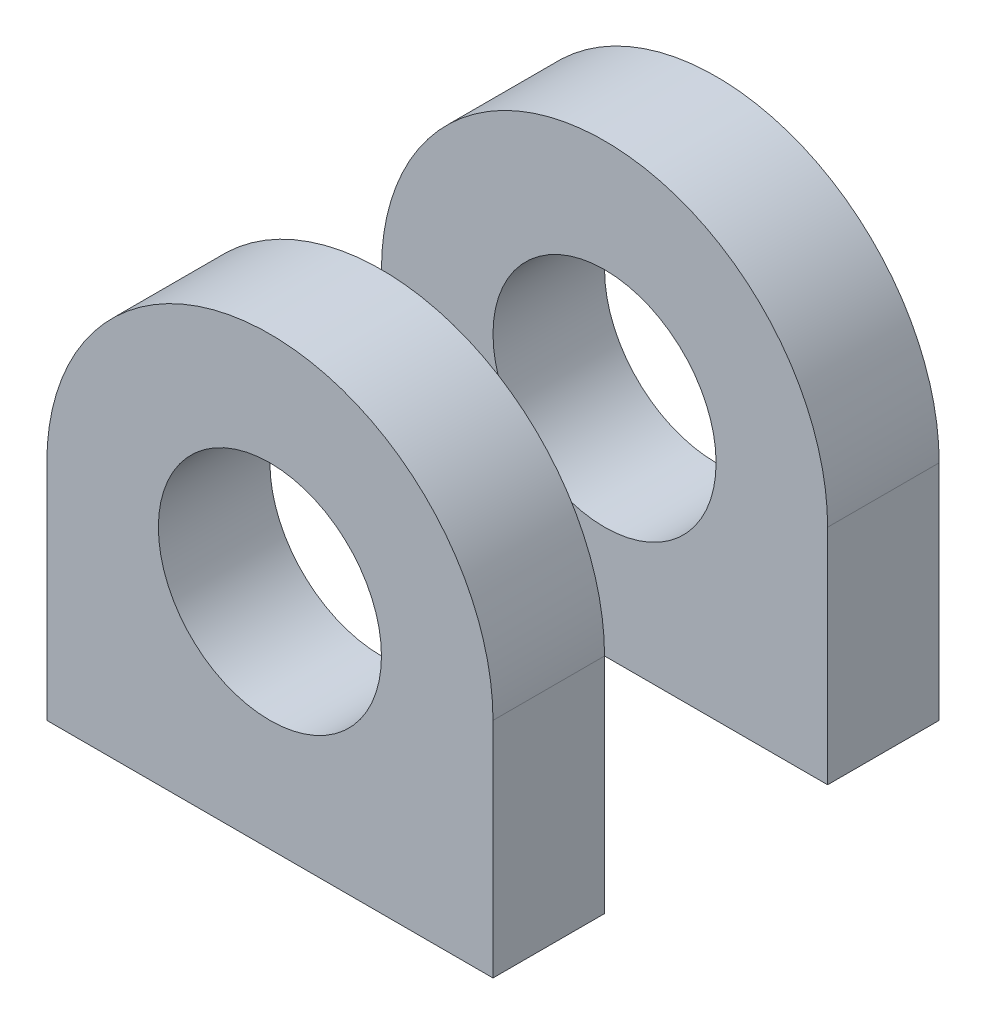
from build123d import *

# Parameters (mm, degrees)
SKETCH_1_W               = 200
SKETCH_1_H               = 200
EXTRUDE_1_DEPTH          = 100
EXTRUDE_2_DEPTH          = 100
CUT_EXTRUDE_1_DEPTH      = 245.948974278
CUT_EXTRUDE_1_DEPTH_BACK = 245.948974278
SKETCH_4_W               = 100
SKETCH_4_H               = 200
CUT_EXTRUDE_2_DEPTH      = 301
CUT_EXTRUDE_2_DEPTH_BACK = 301
SKETCH_5_R               = 50


with BuildPart() as part:
    # 草图1 → 凸台-拉伸1 (new body)
    with BuildSketch(Plane(origin=(0, 0, 0), x_dir=(1, 0, 0), z_dir=(0, 1, 0))):
        Rectangle(SKETCH_1_W, SKETCH_1_H)
    extrude(amount=EXTRUDE_1_DEPTH)

    # 草图2 → 凸台-拉伸2 (add, symmetric)
    with BuildSketch(Plane.XY):
        with BuildLine():
            Line((-100, 100), (100, 100))
            ThreePointArc((100, 100), (0, 200), (-100, 100))
        make_face()
    extrude(amount=EXTRUDE_2_DEPTH, both=True)

    # 草图4 → 切除-拉伸1 (cut, two sides: drawn at the far end of the back side and taken through both)
    with BuildSketch(Plane(origin=(0, 0, 0), x_dir=(0, 0, -1), z_dir=(1, 0, 0)).offset(-CUT_EXTRUDE_1_DEPTH_BACK)):
        with Locations((0, 100)):
            Rectangle(SKETCH_4_W, SKETCH_4_H)
    extrude(amount=CUT_EXTRUDE_1_DEPTH + CUT_EXTRUDE_1_DEPTH_BACK, mode=Mode.SUBTRACT)


with BuildPart() as cut_extrude_1_piece_1:
    # of the separate pieces the step leaves, piece 1, a body of its own (cut_extrude_1_pieces)
    add(part.part.solids().sort_by_distance((-100, 0, 100))[0])


with BuildPart() as cut_extrude_1_piece_2:
    # of the separate pieces the step leaves, piece 2, a body of its own (cut_extrude_1_pieces)
    add(part.part.solids().sort_by_distance((-100, 0, -100))[0])


with BuildPart() as cut_extrude_2_tool:
    # 草图5 → 切除-拉伸2 (new, two sides: drawn at the far end of the back side and taken through both)
    with BuildSketch(Plane(origin=(0, 0, -100), x_dir=(-1, 0, 0), z_dir=(0, 0, -1)).offset(-CUT_EXTRUDE_2_DEPTH_BACK)):
        with Locations((0, 100)):
            Circle(SKETCH_5_R)
    extrude(amount=CUT_EXTRUDE_2_DEPTH + CUT_EXTRUDE_2_DEPTH_BACK)


with BuildPart() as cut_extrude_1_piece_1_1:
    add(cut_extrude_1_piece_1.part)

    # 切除-拉伸2: cut by cut_extrude_2_tool
    add(cut_extrude_2_tool.part, mode=Mode.SUBTRACT)


with BuildPart() as cut_extrude_1_piece_2_1:
    add(cut_extrude_1_piece_2.part)

    # 切除-拉伸2: cut by cut_extrude_2_tool
    add(cut_extrude_2_tool.part, mode=Mode.SUBTRACT)


solid = Compound([cut_extrude_1_piece_1_1.part, cut_extrude_1_piece_2_1.part])
